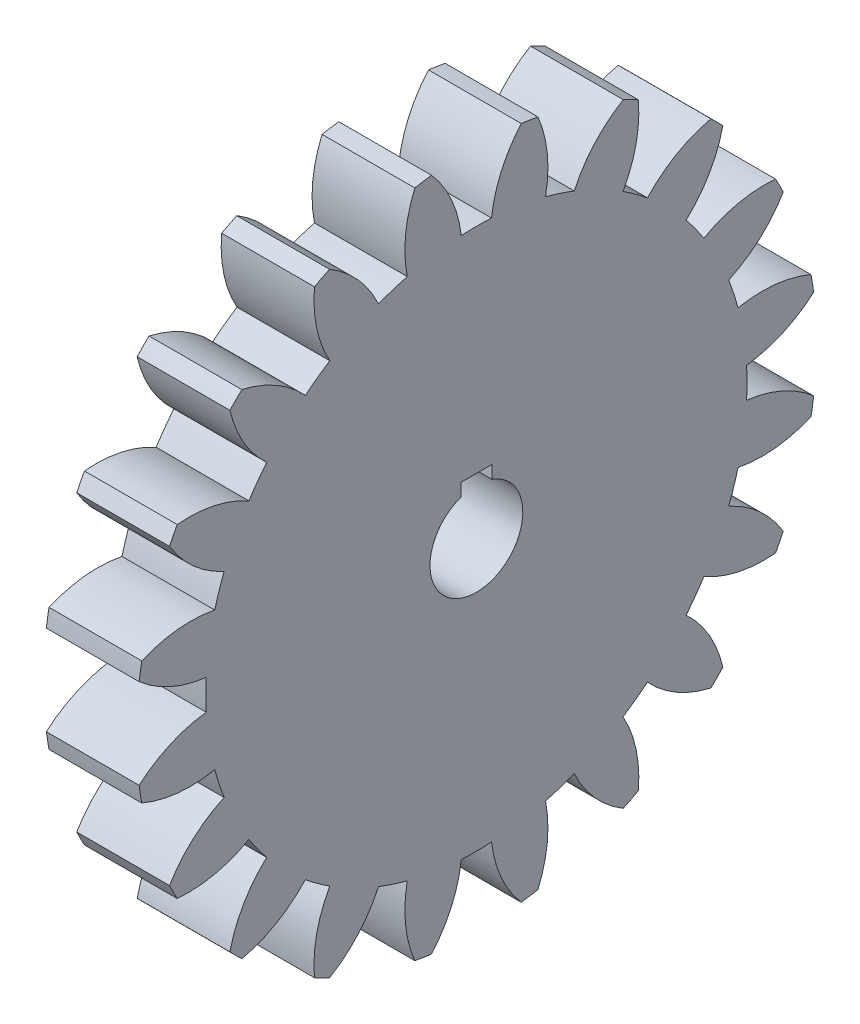
from build123d import *

# Parameters (mm, degrees)
BASPROSKE_W      = 30
BASPROSKE_H      = 110
TOOTHCUT_DEPTH   = 159.429795178
TEETHCUTS_COUNT  = 20
TEETHCUTS_ANGLE  = 342
HUBNEAONESKE_R   = 37.5
HUBNEARONE_DEPTH = 20.0000508
BORSKE_R         = 15
BORE_DEPTH       = 50.0000508
KEYSKE_W         = 10
KEYSKE_H         = 18.3
KEYWAY_DEPTH     = 50.0000508


with BuildPart() as part:
    # BasProSke → Base-Revolve (revolve)
    with BuildSketch(Plane(origin=(0, 0, 0), x_dir=(1, 0, 0), z_dir=(0, 1, 0)), mode=Mode.PRIVATE) as base_revolve_sk:
        with Locations((15, 55)):
            Rectangle(BASPROSKE_W, BASPROSKE_H)
    revolve(base_revolve_sk.sketch.rotate(Axis((-10, 0, 0), (1, 0, 0)), 180), axis=Axis((-10, 0, 0), (1, 0, 0)))

    # TooCutSke → ToothCut (cut, through all)
    with BuildSketch(Plane(origin=(0, 0, 0), x_dir=(0, 0, -1), z_dir=(1, 0, 0))):
        with BuildLine():
            ThreePointArc((4.883806789, 87.362597445), (0, 87.499), (-4.883806789, 87.362597445))
            ThreePointArc((-4.883806789, 87.362597445), (-8.05671411, 98.944403454), (-14.524262272, 109.062525418))
            ThreePointArc((-14.524262272, 109.062525418), (0, 110.0254), (14.524262272, 109.062525418))
            ThreePointArc((14.524262272, 109.062525418), (8.05671411, 98.944403454), (4.883806789, 87.362597445))
        make_face()
    toothcut = extrude(amount=TOOTHCUT_DEPTH, mode=Mode.SUBTRACT)

    # TeethCuts: ToothCut ×20 about axis
    teethcuts_axis = Axis((-10, 0, 0), (1, 0, 0))
    for i in range(1, TEETHCUTS_COUNT):
        add(toothcut.rotate(teethcuts_axis, i * TEETHCUTS_ANGLE / (TEETHCUTS_COUNT - 1)), mode=Mode.SUBTRACT)

    # HubNeaOneSke → HubNearOne (add)
    with BuildSketch(Plane.ZY):
        with Locations(Location((0, 0, 0), (0, 0, 180))):
            Circle(HUBNEAONESKE_R)
    extrude(amount=HUBNEARONE_DEPTH)

    # BorSke → Bore (cut, symmetric)
    with BuildSketch(Plane(origin=(0, 0, 0), x_dir=(0, 0, -1), z_dir=(1, 0, 0))):
        with Locations(Location((0, 0, 0), (0, 0, 180))):
            Circle(BORSKE_R)
    extrude(amount=BORE_DEPTH, both=True, mode=Mode.SUBTRACT)

    # KeySke → Keyway (cut, symmetric)
    with BuildSketch(Plane(origin=(0, 0, 0), x_dir=(0, 0, -1), z_dir=(1, 0, 0))):
        with Locations((0, 9.15)):
            Rectangle(KEYSKE_W, KEYSKE_H)
    extrude(amount=KEYWAY_DEPTH, both=True, mode=Mode.SUBTRACT)


solid = part.part
